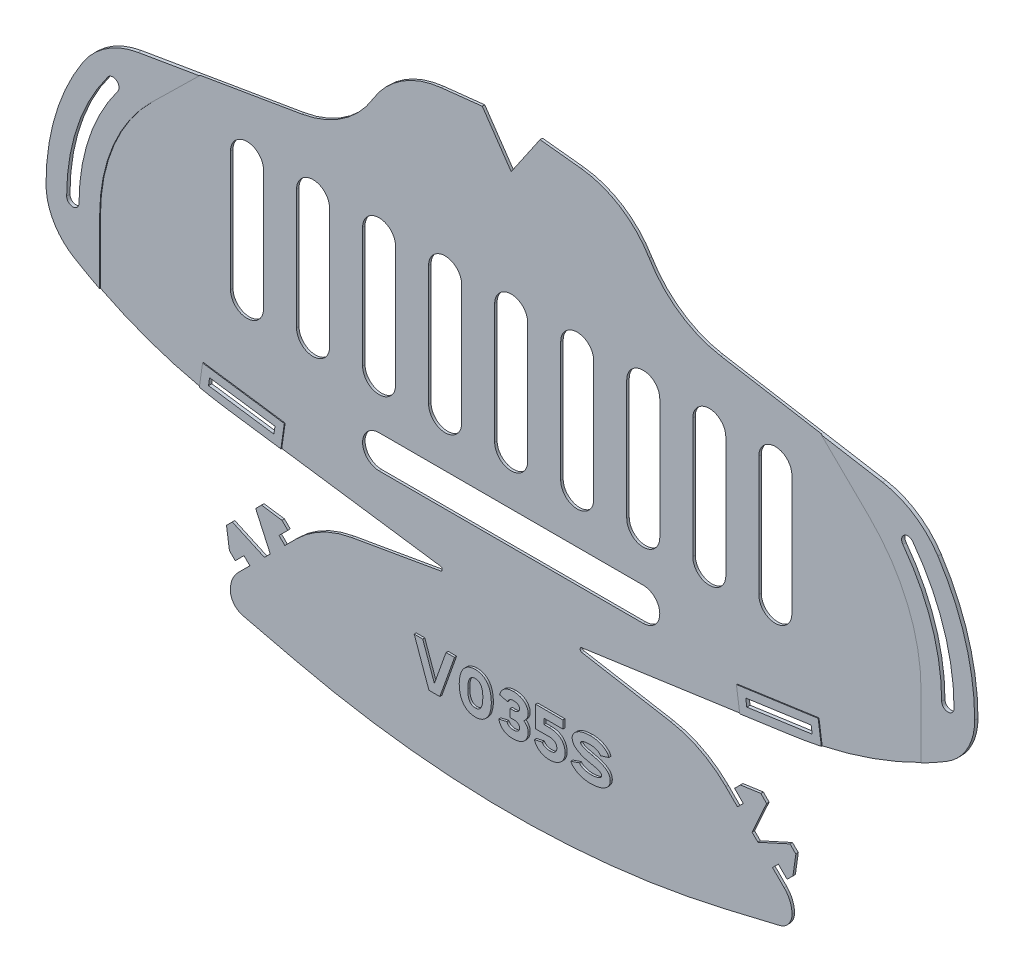
from build123d import *

# Parameters (mm, degrees)
MAIN_SHAPE_DEPTH                   = 0.6
ELASTIC_ATTACHMENT_POINTS_DEPTH    = 184.525502315
REINFORCED_ATTACHMENT_POINTS_DEPTH = 0.2
TAB_SLITS_DEPTH                    = 184.525502315
REINFORCED_TAB_SLITS_DEPTH         = 0.2
TAB_FLEX_RELIEF_DEPTH              = 184.525502315
TAB_FLEX_RELIEF_DEPTH_BACK         = 184.525502315
BREATHING_SLITS_DEPTH              = 184.525502315
VERSION_NUMBER_DEPTH               = 0.5
FILLET1_R                          = 0.5


with BuildPart() as part:
    # Sketch1 → Main Shape (new body)
    with BuildSketch(Plane.XY):
        with BuildLine():
            Line((0, -10.235233266), (-7, 0))
            Line((-7, 0), (-16.941855461, -1.076805455))
            ThreePointArc((-16.941855461, -1.076805455), (-26.448172688, -4.42923559), (-33.461443341, -11.669600897))
            ThreePointArc((-33.461443341, -11.669600897), (-40.804108255, -19.481824954), (-50.74391922, -23.5))
            Line((-50.74391922, -23.5), (-90.180351554, -30.190874742))
            ThreePointArc((-90.180351554, -30.190874742), (-97.811505455, -33.190405434), (-103.597722286, -39))
            ThreePointArc((-103.597722286, -39), (-110.227482046, -53.35351039), (-112.5, -69))
            ThreePointArc((-112.5, -69), (-110.685143325, -75.893640703), (-105.711102551, -81))
            ThreePointArc((-105.711102551, -81), (-87.655491519, -89.524485559), (-68.266232563, -94.291935705))
            Line((-68.266232563, -94.291935705), (-14, -102))
            Line((-14, -102), (-38.626554922, -106.304973016))
            ThreePointArc((-38.626554922, -106.304973016), (-45.849449199, -108.748014338), (-52, -113.254607005))
            Line((-52, -113.254607005), (-54.828307349, -116.0831539))
            Line((-54.828307349, -116.0831539), (-56.242580797, -114.669000226))
            Line((-56.242580797, -114.669000226), (-54.121350285, -112.547590054))
            Line((-54.121350285, -112.547590054), (-55.535623732, -111.13343638))
            Line((-55.535623732, -111.13343638), (-60.48540114, -110.426539202))
            Line((-60.48540114, -110.426539202), (-68.970323187, -118.912179887))
            Line((-68.970323187, -118.912179887), (-68.263006804, -123.861897408))
            Line((-68.263006804, -123.861897408), (-66.848733357, -125.276051082))
            Line((-66.848733357, -125.276051082), (-64.727502845, -123.154640911))
            Line((-64.727502845, -123.154640911), (-63.313229397, -124.568794586))
            Line((-63.313229397, -124.568794586), (-66.141536747, -127.397341481))
            ThreePointArc((-66.141536747, -127.397341481), (-67.550417669, -129.506025763), (-68.045148042, -131.993340924))
            ThreePointArc((-68.045148042, -131.993340924), (-67.183295285, -134.473669911), (-64.9691321, -135.885159709))
            Line((-64.9691321, -135.885159709), (-52.436095294, -138.860716087))
            ThreePointArc((-52.436095294, -138.860716087), (-26.397134772, -143.459954927), (0, -145))
            ThreePointArc((0, -145), (26.397134772, -143.459954927), (52.436095294, -138.860716087))
            Line((52.436095294, -138.860716087), (64.9691321, -135.885159709))
            ThreePointArc((64.9691321, -135.885159709), (67.183295285, -134.473669911), (68.045148042, -131.993340924))
            ThreePointArc((68.045148042, -131.993340924), (67.550417669, -129.506025763), (66.141536747, -127.397341481))
            Line((66.141536747, -127.397341481), (63.313229397, -124.568794586))
            Line((63.313229397, -124.568794586), (64.727502845, -123.154640911))
            Line((64.727502845, -123.154640911), (66.848733357, -125.276051082))
            Line((66.848733357, -125.276051082), (68.263006804, -123.861897408))
            Line((68.263006804, -123.861897408), (68.970323187, -118.912179887))
            Line((68.970323187, -118.912179887), (60.48540114, -110.426539202))
            Line((60.48540114, -110.426539202), (55.535623732, -111.13343638))
            Line((55.535623732, -111.13343638), (54.121350285, -112.547590054))
            Line((54.121350285, -112.547590054), (56.242580797, -114.669000226))
            Line((56.242580797, -114.669000226), (54.828307349, -116.0831539))
            Line((54.828307349, -116.0831539), (52, -113.254607005))
            ThreePointArc((52, -113.254607005), (45.849449199, -108.748014338), (38.626554922, -106.304973016))
            Line((38.626554922, -106.304973016), (14, -102))
            Line((14, -102), (68.266232563, -94.291935705))
            ThreePointArc((68.266232563, -94.291935705), (87.655491519, -89.524485559), (105.711102551, -81))
            ThreePointArc((105.711102551, -81), (110.685143325, -75.893640703), (112.5, -69))
            ThreePointArc((112.5, -69), (110.227482046, -53.35351039), (103.597722286, -39))
            ThreePointArc((103.597722286, -39), (97.811505455, -33.190405434), (90.180351554, -30.190874742))
            Line((90.180351554, -30.190874742), (50.74391922, -23.5))
            ThreePointArc((50.74391922, -23.5), (40.804108255, -19.481824954), (33.461443341, -11.669600897))
            ThreePointArc((33.461443341, -11.669600897), (26.448172688, -4.42923559), (16.941855461, -1.076805455))
            Line((16.941855461, -1.076805455), (7, 0))
            Line((7, 0), (0, -10.235233266))
        make_face()
    extrude(amount=MAIN_SHAPE_DEPTH)

    # Sketch2 → Elastic Attachment Points (cut, through all)
    with BuildSketch(Plane.XY.offset(0.6)):
        with BuildLine():
            ThreePointArc((-97.5, -39), (-104.934164903, -53.188611699), (-107.5, -69))
            ThreePointArc((-107.5, -69), (-106, -70.5), (-104.5, -69))
            ThreePointArc((-104.5, -69), (-102.088115008, -54.137294997), (-95.1, -40.8))
            ThreePointArc((-95.1, -40.8), (-95.4, -38.7), (-97.5, -39))
        make_face()
        with BuildLine():
            ThreePointArc((97.5, -39), (104.934164903, -53.188611699), (107.5, -69))
            ThreePointArc((107.5, -69), (106, -70.5), (104.5, -69))
            ThreePointArc((104.5, -69), (102.088115008, -54.137294997), (95.1, -40.8))
            ThreePointArc((95.1, -40.8), (95.4, -38.7), (97.5, -39))
        make_face()
    extrude(amount=-ELASTIC_ATTACHMENT_POINTS_DEPTH, mode=Mode.SUBTRACT)

    # Sketch7 → Reinforced Attachment Points (add)
    # profile 1 of 2: a face of its own
    with BuildSketch(Plane.XY.offset(0.6)):
        with BuildLine():
            Line((-99.5, -69), (-99.5, -84.438405623))
            ThreePointArc((-99.5, -84.438405623), (-102.636073846, -82.774338486), (-105.711102551, -81))
            ThreePointArc((-105.711102551, -81), (-110.685143325, -75.893640703), (-112.5, -69))
            ThreePointArc((-112.5, -69), (-110.227482046, -53.35351039), (-103.597722286, -39))
            ThreePointArc((-103.597722286, -39), (-97.811505455, -33.190405434), (-90.180351554, -30.190874742))
            Line((-90.180351554, -30.190874742), (-75.331937335, -27.671659038))
            Line((-75.331937335, -27.671659038), (-86.893876913, -39))
            ThreePointArc((-86.893876913, -39), (-96.22042633, -52.729517991), (-99.5, -69))
        make_face()
        with BuildLine():
            ThreePointArc((-107.5, -69), (-106, -70.5), (-104.5, -69))
            ThreePointArc((-104.5, -69), (-102.088115008, -54.137294997), (-95.1, -40.8))
            ThreePointArc((-95.1, -40.8), (-95.4, -38.7), (-97.5, -39))
            ThreePointArc((-97.5, -39), (-104.934164903, -53.188611699), (-107.5, -69))
        make_face(mode=Mode.SUBTRACT)
    # profile 2 of 2: a face of its own
    with BuildSketch(Plane.XY.offset(0.6)):
        with BuildLine():
            Line((75.331937335, -27.671659038), (90.180351554, -30.190874742))
            ThreePointArc((90.180351554, -30.190874742), (97.811505455, -33.190405434), (103.597722286, -39))
            ThreePointArc((103.597722286, -39), (110.227482046, -53.35351039), (112.5, -69))
            ThreePointArc((112.5, -69), (110.685143325, -75.893640703), (105.711102551, -81))
            ThreePointArc((105.711102551, -81), (102.636073846, -82.774338486), (99.5, -84.438405623))
            Line((99.5, -84.438405623), (99.5, -69))
            ThreePointArc((99.5, -69), (96.22042633, -52.729517991), (86.893876913, -39))
            Line((86.893876913, -39), (75.331937335, -27.671659038))
        make_face()
        with BuildLine():
            ThreePointArc((104.5, -69), (106, -70.5), (107.5, -69))
            ThreePointArc((107.5, -69), (104.934164903, -53.188611699), (97.5, -39))
            ThreePointArc((97.5, -39), (95.4, -38.7), (95.1, -40.8))
            ThreePointArc((95.1, -40.8), (102.088115008, -54.137294997), (104.5, -69))
        make_face(mode=Mode.SUBTRACT)
    extrude(amount=REINFORCED_ATTACHMENT_POINTS_DEPTH)

    # Sketch6 → Tab Slits (cut, through all)
    with BuildSketch(Plane.XY.offset(0.6)):
        Polygon((-73.122472744, -91.582072346), (-57.281477317, -93.832153206), (-57.02834322, -92.050041221), (-72.869338647, -89.79996036), align=None)
        Polygon((73.122472744, -91.582072346), (72.869338647, -89.79996036), (57.02834322, -92.050041221), (57.281477317, -93.832153206), align=None)
    extrude(amount=-TAB_SLITS_DEPTH, mode=Mode.SUBTRACT)

    # Sketch9 → Reinforced Tab Slits (add)
    # profile 1 of 2: a face of its own
    with BuildSketch(Plane.XY.offset(0.6)):
        with BuildLine():
            Line((-55.582612996, -96.093537742), (-54.766958684, -90.3511769))
            Line((-54.766958684, -90.3511769), (-74.568202968, -87.538575825))
            Line((-74.568202968, -87.538575825), (-75.347469499, -93.024759795))
            ThreePointArc((-75.347469499, -93.024759795), (-71.81824936, -93.72204393), (-68.266232563, -94.291935705))
            Line((-68.266232563, -94.291935705), (-55.582612996, -96.093537742))
        make_face()
        Polygon((-57.281477317, -93.832153206), (-57.02834322, -92.050041221), (-72.869338647, -89.79996036), (-73.122472744, -91.582072346), align=None, mode=Mode.SUBTRACT)
    # profile 2 of 2: a face of its own
    with BuildSketch(Plane.XY.offset(0.6)):
        with BuildLine():
            Line((68.266232563, -94.291935705), (55.582612996, -96.093537742))
            Line((55.582612996, -96.093537742), (54.766958684, -90.3511769))
            Line((54.766958684, -90.3511769), (74.568202968, -87.538575825))
            Line((74.568202968, -87.538575825), (75.347469499, -93.024759795))
            ThreePointArc((75.347469499, -93.024759795), (71.81824936, -93.72204393), (68.266232563, -94.291935705))
        make_face()
        Polygon((57.02834322, -92.050041221), (72.869338647, -89.79996036), (73.122472744, -91.582072346), (57.281477317, -93.832153206), align=None, mode=Mode.SUBTRACT)
    extrude(amount=REINFORCED_TAB_SLITS_DEPTH)

    # Sketch11 → Tab Flex Relief (cut, two sides: drawn at the far end of the back side and taken through both)
    with BuildSketch(Plane.XY.offset(0.6).offset(-TAB_FLEX_RELIEF_DEPTH_BACK)):
        Polygon((-67.556169513, -117.49790644), (-59.777845211, -121.033110967), (-58.363691536, -119.618837519), (-61.899554814, -111.840812649), align=None)
        Polygon((61.899554814, -111.840812649), (67.556169513, -117.49790644), (59.777845211, -121.033110967), (58.363691536, -119.618837519), align=None)
    extrude(amount=TAB_FLEX_RELIEF_DEPTH + TAB_FLEX_RELIEF_DEPTH_BACK, mode=Mode.SUBTRACT)

    # Sketch3 → Breathing Slits (cut, through all)
    with BuildSketch(Plane.XY.offset(0.6)):
        with BuildLine():
            Line((4, -39.9), (4, -69))
            ThreePointArc((4, -69), (0, -73), (-4, -69))
            Line((-4, -69), (-4, -39.9))
            ThreePointArc((-4, -39.9), (0, -35.9), (4, -39.9))
        make_face()
        with BuildLine():
            Line((-12, -39.9), (-12, -69))
            ThreePointArc((-12, -69), (-16, -73), (-20, -69))
            Line((-20, -69), (-20, -39.9))
            ThreePointArc((-20, -39.9), (-16, -35.9), (-12, -39.9))
        make_face()
        with BuildLine():
            Line((-28, -39.9), (-28, -69))
            ThreePointArc((-28, -69), (-32, -73), (-36, -69))
            Line((-36, -69), (-36, -39.9))
            ThreePointArc((-36, -39.9), (-32, -35.9), (-28, -39.9))
        make_face()
        with BuildLine():
            Line((-32, -81), (32, -81))
            ThreePointArc((32, -81), (36, -85), (32, -89))
            Line((32, -89), (-32, -89))
            ThreePointArc((-32, -89), (-36, -85), (-32, -81))
        make_face()
        with BuildLine():
            Line((-44, -39.9), (-44, -69))
            ThreePointArc((-44, -69), (-48, -73), (-52, -69))
            Line((-52, -69), (-52, -39.9))
            ThreePointArc((-52, -39.9), (-48, -35.9), (-44, -39.9))
        make_face()
        with BuildLine():
            Line((-60, -39.9), (-60, -69))
            ThreePointArc((-60, -69), (-64, -73), (-68, -69))
            Line((-68, -69), (-68, -39.9))
            ThreePointArc((-68, -39.9), (-64, -35.9), (-60, -39.9))
        make_face()
        with BuildLine():
            Line((12, -39.9), (12, -69))
            ThreePointArc((12, -69), (16, -73), (20, -69))
            Line((20, -69), (20, -39.9))
            ThreePointArc((20, -39.9), (16, -35.9), (12, -39.9))
        make_face()
        with BuildLine():
            Line((28, -39.9), (28, -69))
            ThreePointArc((28, -69), (32, -73), (36, -69))
            Line((36, -69), (36, -39.9))
            ThreePointArc((36, -39.9), (32, -35.9), (28, -39.9))
        make_face()
        with BuildLine():
            Line((44, -39.9), (44, -69))
            ThreePointArc((44, -69), (48, -73), (52, -69))
            Line((52, -69), (52, -39.9))
            ThreePointArc((52, -39.9), (48, -35.9), (44, -39.9))
        make_face()
        with BuildLine():
            Line((60, -39.9), (60, -69))
            ThreePointArc((60, -69), (64, -73), (68, -69))
            Line((68, -69), (68, -39.9))
            ThreePointArc((68, -39.9), (64, -35.9), (60, -39.9))
        make_face()
    extrude(amount=-BREATHING_SLITS_DEPTH, mode=Mode.SUBTRACT)

    # Sketch8 → Version Number (add)
    # profile 1 of 5: a face of its own
    with BuildSketch(Plane.XY.offset(0.6)):
        Polygon((-19.423503187, -128.5), (-16.788582552, -128.5), (-13.21715398, -118.5), (-15.280646044, -118.5), (-18.106042869, -126.420634921), (-20.931439695, -118.5), (-22.994931758, -118.5), align=None)
    # profile 2 of 5: a face of its own
    with BuildSketch(Plane.XY.offset(0.6)):
        with BuildLine():
            add(Edge.make_bspline(
                [(-8.194979301, -118.5), (-8.339345265, -118.505695671), (-8.622100412, -118.51685121), (-9.035235414, -118.5745591), (-9.423078117, -118.680335178), (-9.790279692, -118.819656178), (-10.132555264, -119.003303471), (-10.456348439, -119.221085059), (-10.749359054, -119.487440084), (-11.024814107, -119.785519386), (-11.270677287, -120.12453761), (-11.484112997, -120.500892889), (-11.666075773, -120.912503383), (-11.814996937, -121.360169436), (-11.930545985, -121.844506854), (-12.018299924, -122.364485904), (-12.069854364, -122.921030718), (-12.080511094, -123.303893775), (-12.085989675, -123.500722112)],
                knots=[0, 0, 0, 0, 0.970159994, 1.900155169, 2.79438565, 3.665191596, 4.532301255, 5.397946305, 6.279238358, 7.185391655, 8.120220805, 9.085107467, 10.08639026, 11.138349125, 12.249459105, 13.427760297, 14.677622047, 16, 16, 16, 16], degree=3))
            add(Edge.make_bspline(
                [(-12.085989675, -123.500722112), (-12.080566284, -123.69832053), (-12.070057658, -124.081196856), (-12.018090588, -124.637697099), (-11.930644698, -125.156966907), (-11.814534842, -125.641884177), (-11.666592179, -126.090648826), (-11.484045554, -126.502814664), (-11.270735249, -126.879260377), (-11.024654069, -127.218032326), (-10.750262332, -127.51659595), (-10.454794786, -127.779877259), (-10.133443543, -128.000979952), (-9.790086238, -128.183632701), (-9.423533184, -128.324409639), (-9.034580104, -128.425104033), (-8.622801784, -128.488808035), (-8.34002041, -128.496221224), (-8.195876335, -128.5)],
                knots=[0, 0, 0, 0, 1.327400251, 2.57203543, 3.750234214, 4.861247624, 5.917991082, 6.919186852, 7.883989653, 8.818737555, 9.724812096, 10.602616666, 11.47109776, 12.338132057, 13.208862319, 14.101698703, 15.032365954, 16, 16, 16, 16], degree=3))
            add(Edge.make_bspline(
                [(-8.195876335, -128.5), (-8.051736666, -128.496210687), (-7.768963937, -128.488776824), (-7.357123523, -128.425221319), (-6.967701192, -128.323813307), (-6.600339713, -128.184839888), (-6.257950234, -128.000200623), (-5.936903828, -127.779984633), (-5.641505159, -127.516566079), (-5.367095359, -127.218040576), (-5.121014732, -126.879258594), (-4.90772199, -126.502813072), (-4.725100113, -126.090657611), (-4.577462376, -125.641847927), (-4.460149525, -125.157235462), (-4.377707379, -124.637275213), (-4.320051154, -124.081441513), (-4.312140786, -123.698369528), (-4.308059402, -123.500722112)],
                knots=[0, 0, 0, 0, 0.96765053, 1.898333634, 2.791185227, 3.666728435, 4.529238626, 5.397734515, 6.275554038, 7.181644014, 8.116407839, 9.081227075, 10.082439899, 11.139201358, 12.250233695, 13.427610983, 14.672766316, 16, 16, 16, 16], degree=3))
            add(Edge.make_bspline(
                [(-4.308059402, -123.500722112), (-4.312200232, -123.303845261), (-4.320256936, -122.920787111), (-4.377500915, -122.364907693), (-4.460249109, -121.844238468), (-4.576998745, -121.360205444), (-4.72561671, -120.912494629), (-4.907654528, -120.500894477), (-5.121072705, -120.124539393), (-5.366935299, -119.785511139), (-5.642408536, -119.487469991), (-5.935349744, -119.220977415), (-6.258834607, -119.004075275), (-6.600146255, -118.818455332), (-6.968156818, -118.680915067), (-7.356473451, -118.574534625), (-7.769322528, -118.516562336), (-8.051807359, -118.506550382), (-8.195876335, -118.501444225)],
                knots=[0, 0, 0, 0, 1.322391154, 2.572941942, 3.750582404, 4.861863084, 5.913983562, 6.915420183, 7.880455081, 8.815427849, 9.721720359, 10.603147806, 11.468925845, 12.331628829, 13.207367743, 14.101735605, 15.031873656, 16, 16, 16, 16], degree=3))
            Line((-8.195876335, -118.501444225), (-8.194979301, -118.5))
        make_face()
        with BuildLine():
            add(Edge.make_bspline(
                [(-8.194979301, -126.579365079), (-8.264298849, -126.580142247), (-8.400309175, -126.581667111), (-8.597762411, -126.549518886), (-8.784213506, -126.50001124), (-8.958390802, -126.424863461), (-9.122186162, -126.32888552), (-9.272801706, -126.207295998), (-9.411160729, -126.063513987), (-9.538475787, -125.896932623), (-9.652347089, -125.703005633), (-9.750878078, -125.478827118), (-9.831615493, -125.222713054), (-9.900792251, -124.937433189), (-9.952043616, -124.621763618), (-9.990547181, -124.276117752), (-10.016413845, -123.899148475), (-10.01977312, -123.63702081), (-10.021519845, -123.500722112)],
                knots=[0, 0, 0, 0, 0.820209436, 1.609314487, 2.362064528, 3.101854642, 3.850272983, 4.605479342, 5.3882482, 6.210255141, 7.084711649, 8.047345167, 9.106040688, 10.263495908, 11.523832392, 12.893430008, 14.384674726, 16, 16, 16, 16], degree=3))
            add(Edge.make_bspline(
                [(-10.021519845, -123.500722112), (-10.019766233, -123.364424703), (-10.016393714, -123.102299516), (-9.99061807, -122.725313211), (-9.951725095, -122.378974061), (-9.901428811, -122.063111109), (-9.831211388, -121.778059679), (-9.750908357, -121.522619394), (-9.652378197, -121.298401339), (-9.538343537, -121.104640769), (-9.411953233, -120.937923887), (-9.271990747, -120.796456824), (-9.122269996, -120.674830172), (-8.958430111, -120.578630118), (-8.783784091, -120.50465551), (-8.598416544, -120.450210023), (-8.400272836, -120.423926373), (-8.264829563, -120.422146526), (-8.195876335, -120.421240419)],
                knots=[0, 0, 0, 0, 1.616177311, 3.108208617, 4.478528655, 5.748482895, 6.897727805, 7.956981757, 8.920123036, 9.795040793, 10.617481319, 11.394165711, 12.149770419, 12.898583529, 13.63876386, 14.394368568, 15.182584207, 16, 16, 16, 16], degree=3))
            add(Edge.make_bspline(
                [(-8.195876335, -120.421240419), (-8.1269247, -120.422149219), (-7.991484555, -120.423934355), (-7.793318335, -120.450179948), (-7.608031747, -120.504762296), (-7.4336984, -120.577982734), (-7.271473065, -120.675595023), (-7.122003307, -120.796360516), (-6.982103061, -120.937948802), (-6.855738749, -121.104645093), (-6.741514011, -121.298351736), (-6.643728731, -121.523063414), (-6.559768872, -121.777554553), (-6.490579773, -122.063195246), (-6.439950095, -122.378948588), (-6.40115798, -122.725320897), (-6.375352316, -123.102297333), (-6.371984165, -123.364423957), (-6.370232825, -123.500722112)],
                knots=[0, 0, 0, 0, 0.817669415, 1.606129616, 2.361968767, 3.102378757, 3.843623451, 4.599462602, 5.376387978, 6.199083685, 7.074272906, 8.037713021, 9.100132017, 10.249733507, 11.520081779, 12.89082699, 14.383321233, 16, 16, 16, 16], degree=3))
            add(Edge.make_bspline(
                [(-6.370232825, -123.500722112), (-6.371977279, -123.637021556), (-6.375332187, -123.899150658), (-6.401228862, -124.276110066), (-6.439631812, -124.621789015), (-6.491215031, -124.937349474), (-6.559356896, -125.223220708), (-6.643758409, -125.478383327), (-6.741545264, -125.703055181), (-6.855606442, -125.896928348), (-6.982895585, -126.063488884), (-7.121191675, -126.207393621), (-7.271555765, -126.328120602), (-7.433736992, -126.425517476), (-7.607602242, -126.499891817), (-7.79397158, -126.549600883), (-7.991161208, -126.581404352), (-8.126859744, -126.580608552), (-8.195876335, -126.580203806)],
                knots=[0, 0, 0, 0, 1.616177474, 3.108208932, 4.478529109, 5.739530511, 6.897596372, 7.959685938, 8.922827315, 9.797745161, 10.620185771, 11.403367596, 12.15897238, 12.899987232, 13.640167639, 14.39331481, 15.182836171, 16, 16, 16, 16], degree=3))
            Line((-8.195876335, -126.580203806), (-8.194979301, -126.579365079))
        make_face(mode=Mode.SUBTRACT)
    # profile 3 of 5: a face of its own
    with BuildSketch(Plane.XY.offset(0.6)):
        with BuildLine():
            Line((1.127625506, -124.404761905), (1.222863602, -124.404761905))
            add(Edge.make_bspline(
                [(1.222863602, -124.404761905), (1.323131497, -124.411299477), (1.513766698, -124.423729091), (1.780432995, -124.486416557), (2.013227083, -124.578961335), (2.204914461, -124.709274647), (2.358559762, -124.861365804), (2.472887201, -125.032278467), (2.542548445, -125.222537651), (2.551423882, -125.355662585), (2.555900914, -125.422814713)],
                knots=[0, 0, 0, 0, 1.293250512, 2.458803691, 3.516087315, 4.504014474, 5.424976382, 6.287022232, 7.135923681, 8, 8, 8, 8], degree=3))
            add(Edge.make_bspline(
                [(2.555900914, -125.422814713), (2.552611363, -125.504440638), (2.546250377, -125.662280257), (2.477103006, -125.887718235), (2.358748148, -126.087113891), (2.223832311, -126.23073656), (2.094667656, -126.331172702), (1.97977866, -126.395688771), (1.850927761, -126.450185226), (1.707899755, -126.49595932), (1.551178295, -126.532200484), (1.380219358, -126.560253509), (1.194395636, -126.575366879), (1.06555664, -126.5785552), (0.998937015, -126.580203806)],
                knots=[0, 0, 0, 0, 1.334208421, 2.579951764, 3.816761299, 5.103436918, 5.78324123, 6.491044783, 7.25516555, 8.072210043, 8.94833879, 9.888551629, 10.908219533, 12, 12, 12, 12], degree=3))
            add(Edge.make_bspline(
                [(0.998937015, -126.580203806), (0.924543424, -126.579024673), (0.774058831, -126.576639503), (0.547412285, -126.537785365), (0.319137327, -126.472292557), (0.092039927, -126.384048723), (-0.122116673, -126.26078738), (-0.299439202, -126.088542309), (-0.440608958, -125.87591894), (-0.495178112, -125.712337396), (-0.52358078, -125.62719493)],
                knots=[0, 0, 0, 0, 0.920255672, 1.861508472, 2.836752399, 3.857684402, 4.873720033, 5.872631744, 6.892727297, 8, 8, 8, 8], degree=3))
            Line((-0.52358078, -125.62719493), (-2.507295129, -126.071428571))
            add(Edge.make_bspline(
                [(-2.507295129, -126.071428571), (-2.484459844, -126.160336196), (-2.439503699, -126.335369884), (-2.34649482, -126.586847228), (-2.235057383, -126.824009097), (-2.109901039, -127.050933458), (-1.961749952, -127.26169635), (-1.797581413, -127.459934114), (-1.618349884, -127.647890635), (-1.418017591, -127.819546753), (-1.200570613, -127.976110236), (-0.963424039, -128.112422888), (-0.708858541, -128.230322428), (-0.433321152, -128.322934743), (-0.141203536, -128.399729339), (0.170065033, -128.45295857), (0.498896012, -128.491934936), (0.724777504, -128.497268097), (0.840484937, -128.5)],
                knots=[0, 0, 0, 0, 0.97897001, 1.927311989, 2.855460552, 3.773345826, 4.68872018, 5.599601379, 6.518067916, 7.456260856, 8.41049365, 9.372940738, 10.370680865, 11.39871829, 12.470472684, 13.590411754, 14.765692276, 16, 16, 16, 16], degree=3))
            add(Edge.make_bspline(
                [(0.840484937, -128.5), (0.996754822, -128.494245394), (1.299280873, -128.483104934), (1.737089662, -128.435865678), (2.142738044, -128.358387224), (2.516512836, -128.252017359), (2.861386529, -128.123277608), (3.17237195, -127.961059217), (3.454463385, -127.774497038), (3.702117407, -127.55815064), (3.91651212, -127.319870658), (4.108269694, -127.071551477), (4.266058985, -126.805353082), (4.398589639, -126.527874631), (4.497217263, -126.234513517), (4.568680967, -125.928607165), (4.610353368, -125.607680152), (4.615471001, -125.38925418), (4.618074337, -125.278141077)],
                knots=[0, 0, 0, 0, 1.338573179, 2.591371041, 3.766159492, 4.869841347, 5.915366975, 6.911991706, 7.866279139, 8.804635322, 9.718527085, 10.607232931, 11.486170613, 12.362759498, 13.235296616, 14.130311397, 15.048891017, 16, 16, 16, 16], degree=3))
            add(Edge.make_bspline(
                [(4.618074337, -125.278141077), (4.61272591, -125.181448476), (4.602199151, -124.991138356), (4.546883566, -124.713321084), (4.454523678, -124.451246621), (4.325331939, -124.20784025), (4.174132234, -123.977552327), (3.999000817, -123.764837772), (3.804603771, -123.566155092), (3.660179105, -123.449574998), (3.586987625, -123.39049458)],
                knots=[0, 0, 0, 0, 1.042147361, 2.051151675, 3.039496243, 4.024119517, 5.012016893, 6.002285516, 6.987598979, 8, 8, 8, 8], degree=3))
            add(Edge.make_bspline(
                [(3.586987625, -123.39049458), (3.66016866, -123.325162044), (3.804529417, -123.19628365), (3.998801539, -122.981710509), (4.172972245, -122.755542958), (4.326327997, -122.515248899), (4.453529521, -122.261642739), (4.54635361, -121.993228321), (4.602261874, -121.711764564), (4.612747261, -121.519933272), (4.618074337, -121.42247384)],
                knots=[0, 0, 0, 0, 1.026734164, 2.025389794, 3.025877614, 4.013273499, 5.006315215, 5.989929209, 6.978788314, 8, 8, 8, 8], degree=3))
            add(Edge.make_bspline(
                [(4.618074337, -121.42247384), (4.613992472, -121.322020203), (4.605973493, -121.124675201), (4.559030795, -120.835115028), (4.483852781, -120.558271626), (4.376410723, -120.294880847), (4.242995128, -120.042407113), (4.078183213, -119.803370965), (3.887154035, -119.574583887), (3.666323177, -119.361344215), (3.419624019, -119.166999953), (3.147815802, -118.995833154), (2.853277113, -118.84746887), (2.53250106, -118.730513446), (2.190585443, -118.632405283), (1.824705607, -118.562780212), (1.435630452, -118.515976725), (1.16824236, -118.506371293), (1.031086712, -118.501444225)],
                knots=[0, 0, 0, 0, 0.933249724, 1.833404674, 2.71837752, 3.592513965, 4.4704886, 5.365912677, 6.284554944, 7.234984132, 8.212272519, 9.196674926, 10.214289296, 11.269589965, 12.363543901, 13.515449053, 14.72555956, 16, 16, 16, 16], degree=3))
            add(Edge.make_bspline(
                [(1.031086712, -118.501444225), (0.917694359, -118.504384419), (0.6965136, -118.510119502), (0.373729331, -118.546209564), (0.067900026, -118.597359567), (-0.2209187, -118.671164203), (-0.491962257, -118.76520159), (-0.74568434, -118.877770477), (-0.982213874, -119.009217236), (-1.199817144, -119.161041577), (-1.40007772, -119.328960798), (-1.581474708, -119.510905494), (-1.746221701, -119.704452098), (-1.890755877, -119.91288512), (-2.020385352, -120.132286581), (-2.126920381, -120.36651166), (-2.22183934, -120.610059019), (-2.265243558, -120.780460499), (-2.287221303, -120.866743363)],
                knots=[0, 0, 0, 0, 1.229240767, 2.397731417, 3.51786287, 4.588673614, 5.625367482, 6.624717489, 7.594406979, 8.554388623, 9.496885304, 10.424058211, 11.336820069, 12.248524965, 13.170856983, 14.095351914, 15.035580601, 16, 16, 16, 16], degree=3))
            Line((-2.287221303, -120.866743363), (-0.380311002, -121.373015873))
            add(Edge.make_bspline(
                [(-0.380311002, -121.373015873), (-0.369013351, -121.326631527), (-0.344497176, -121.22597637), (-0.253996048, -121.081457089), (-0.132147374, -120.927147787), (0.029065401, -120.771324055), (0.226443174, -120.625559671), (0.464533152, -120.514206488), (0.737617538, -120.446844288), (0.930446976, -120.430020784), (1.031086712, -120.421240419)],
                knots=[0, 0, 0, 0, 0.626586808, 1.359708585, 2.222843852, 3.223153095, 4.308434095, 5.447412619, 6.667777482, 8, 8, 8, 8], degree=3))
            add(Edge.make_bspline(
                [(1.031086712, -120.421240419), (1.103119698, -120.423218633), (1.241355187, -120.42701494), (1.438758508, -120.449676308), (1.619050136, -120.474391788), (1.780099542, -120.515621967), (1.925714549, -120.558109891), (2.050323735, -120.618078056), (2.16108507, -120.680273756), (2.275988758, -120.780934624), (2.390316748, -120.912654377), (2.493310701, -121.077310889), (2.553307716, -121.24921056), (2.555046784, -121.365405566), (2.555900914, -121.42247384)],
                knots=[0, 0, 0, 0, 1.26888152, 2.435057415, 3.499383416, 4.470882074, 5.362320585, 6.164854387, 6.902680001, 7.591682225, 8.843898063, 9.963361673, 10.999720905, 12, 12, 12, 12], degree=3))
            add(Edge.make_bspline(
                [(2.555900914, -121.42247384), (2.55083016, -121.49199044), (2.540751961, -121.630155711), (2.465473149, -121.827940252), (2.343947836, -122.008163808), (2.180621089, -122.171288708), (1.973285181, -122.307565764), (1.725748205, -122.408872593), (1.438867872, -122.47003825), (1.235013028, -122.480300003), (1.127535803, -122.485710249)],
                knots=[0, 0, 0, 0, 0.842573162, 1.674626639, 2.532888499, 3.465967991, 4.458251597, 5.524776888, 6.695002246, 8, 8, 8, 8], degree=3))
            Line((1.127535803, -122.485710249), (0.270482649, -122.484126984))
            Line((0.270482649, -122.484126984), (0.270482649, -124.404761905))
            Line((0.270482649, -124.404761905), (1.127625506, -124.404761905))
        make_face()
    # profile 4 of 5: a face of its own
    with BuildSketch(Plane.XY.offset(0.6)):
        with BuildLine():
            Line((9.775337845, -121.753968254), (8.48962356, -121.753968254))
            Line((8.48962356, -121.753968254), (8.48962356, -120.420634921))
            Line((8.48962356, -120.420634921), (13.029306099, -120.420634921))
            Line((13.029306099, -120.420634921), (13.029306099, -118.5))
            Line((13.029306099, -118.5), (6.426131496, -118.5))
            Line((6.426131496, -118.5), (6.426131496, -123.674603175))
            Line((6.426131496, -123.674603175), (9.695972766, -123.674603175))
            add(Edge.make_bspline(
                [(9.695972766, -123.674603175), (9.770062115, -123.675602086), (9.91401415, -123.677542922), (10.123460776, -123.692704514), (10.318978823, -123.723042675), (10.500502342, -123.763288516), (10.667602661, -123.817251662), (10.822190602, -123.879484934), (10.959808977, -123.959553064), (11.087188918, -124.046197885), (11.196072308, -124.149968295), (11.292215354, -124.26484275), (11.375238951, -124.390602025), (11.4416013, -124.530129867), (11.494589218, -124.680251755), (11.533495625, -124.842608973), (11.558840613, -125.017132432), (11.564231712, -125.137973815), (11.567001709, -125.200063241)],
                knots=[0, 0, 0, 0, 1.291340122, 2.50901164, 3.656233385, 4.737231688, 5.745647761, 6.71445312, 7.634539433, 8.515488686, 9.393300537, 10.245701923, 11.122702301, 12.011797026, 12.93168986, 13.892747604, 14.917274139, 16, 16, 16, 16], degree=3))
            add(Edge.make_bspline(
                [(11.567001709, -125.200063241), (11.562789358, -125.300114528), (11.554705086, -125.492131264), (11.474439507, -125.765733398), (11.335298012, -126.004538024), (11.176687621, -126.17434082), (11.024931446, -126.290319351), (10.893200701, -126.365431401), (10.747765282, -126.430026061), (10.58741892, -126.482096845), (10.41362545, -126.52675039), (10.223448808, -126.55439299), (10.019749234, -126.576932347), (9.878449386, -126.5790915), (9.805657593, -126.580203806)],
                knots=[0, 0, 0, 0, 1.417186054, 2.719839454, 3.999831516, 5.306419273, 5.988605249, 6.704054952, 7.452945314, 8.243009127, 9.093975494, 9.995834141, 10.967537284, 12, 12, 12, 12], degree=3))
            add(Edge.make_bspline(
                [(9.805657593, -126.580203806), (9.696749565, -126.574841975), (9.486085258, -126.564470411), (9.181135042, -126.511605126), (8.899262033, -126.424404763), (8.645004793, -126.306180725), (8.423919399, -126.167710506), (8.252075586, -126.007163051), (8.120428121, -125.83604344), (8.079975047, -125.706158133), (8.060388326, -125.643269778)],
                knots=[0, 0, 0, 0, 1.239808568, 2.398201666, 3.511107812, 4.586578273, 5.581900341, 6.46310827, 7.255862013, 8, 8, 8, 8], degree=3))
            Line((8.060388326, -125.643269778), (6.14041721, -126.071428571))
            add(Edge.make_bspline(
                [(6.14041721, -126.071428571), (6.16448707, -126.160548359), (6.212117555, -126.336902466), (6.318191702, -126.587616399), (6.442750727, -126.825640703), (6.587255205, -127.052018478), (6.7560353, -127.263372267), (6.945869768, -127.462365132), (7.157354926, -127.648069148), (7.389363249, -127.81997371), (7.638533945, -127.975914274), (7.904782129, -128.111508549), (8.184281354, -128.229596507), (8.480842823, -128.322648571), (8.790541253, -128.399168227), (9.116165995, -128.452814481), (9.455690826, -128.491742739), (9.687661005, -128.49721594), (9.805657593, -128.5)],
                knots=[0, 0, 0, 0, 0.933358014, 1.846969395, 2.747978179, 3.65058438, 4.560476191, 5.481090533, 6.430749403, 7.405393302, 8.400725728, 9.402100456, 10.426556211, 11.46786461, 12.544569044, 13.652675183, 14.805983081, 16, 16, 16, 16], degree=3))
            add(Edge.make_bspline(
                [(9.805657593, -128.5), (9.942863956, -128.495504774), (10.211298897, -128.486710171), (10.602388899, -128.433418982), (10.974273526, -128.360336182), (11.323807622, -128.252803179), (11.655101454, -128.123435212), (11.962945262, -127.960769192), (12.253038848, -127.774871052), (12.51830574, -127.558743904), (12.757671024, -127.321416343), (12.970278951, -127.067668109), (13.14554311, -126.794179288), (13.298778198, -126.509027952), (13.411884226, -126.203081966), (13.497493192, -125.88344012), (13.551130261, -125.5470022), (13.561748041, -125.31737072), (13.567172145, -125.200063241)],
                knots=[0, 0, 0, 0, 1.17826532, 2.30519616, 3.385644728, 4.42967802, 5.441717964, 6.435616201, 7.414838536, 8.396397341, 9.367976222, 10.306520034, 11.232826888, 12.153236024, 13.081197769, 14.026829533, 14.992003824, 16, 16, 16, 16], degree=3))
            add(Edge.make_bspline(
                [(13.567172145, -125.200063241), (13.563031301, -125.073635127), (13.554923199, -124.826078875), (13.509400062, -124.463686468), (13.431321346, -124.120728156), (13.323339044, -123.797399283), (13.184982817, -123.493469509), (13.014000565, -123.211065096), (12.81498814, -122.946164208), (12.585608818, -122.703396477), (12.327315567, -122.484022512), (12.0414827, -122.292954639), (11.728380488, -122.131495081), (11.388879886, -121.998507068), (11.023034048, -121.892820854), (10.63009766, -121.818407366), (10.211011652, -121.769392953), (9.922149119, -121.760188975), (9.773507896, -121.755452845)],
                knots=[0, 0, 0, 0, 1.047845617, 2.051764646, 3.021184748, 3.957929711, 4.871890627, 5.782411277, 6.68821354, 7.612570783, 8.544147221, 9.490634628, 10.455228194, 11.457623096, 12.507540162, 13.606000757, 14.768109627, 16, 16, 16, 16], degree=3))
            Line((9.773507896, -121.755452845), (9.775337845, -121.753968254))
        make_face()
    # profile 5 of 5: a face of its own
    with BuildSketch(Plane.XY.offset(0.6)):
        with BuildLine():
            add(Edge.make_bspline(
                [(24.502415264, -125.531746032), (24.499528312, -125.436285182), (24.493842146, -125.248264664), (24.443910238, -124.971573191), (24.361673237, -124.706487636), (24.243289395, -124.453940642), (24.088921837, -124.214454259), (23.900036554, -123.987830994), (23.677054966, -123.772935761), (23.420124212, -123.570035613), (23.125292151, -123.378876225), (22.79198702, -123.197945262), (22.417697257, -123.029686218), (22.006911266, -122.866007919), (21.555896576, -122.715136729), (21.064738137, -122.576683253), (20.535410869, -122.442048846), (20.166623289, -122.366313826), (19.976443888, -122.327258171)],
                knots=[0, 0, 0, 0, 0.761030942, 1.498933149, 2.234785869, 2.969649761, 3.716667643, 4.501656281, 5.31785169, 6.182843945, 7.109303426, 8.117634967, 9.205209993, 10.38112034, 11.64403038, 12.997003453, 14.451390136, 16, 16, 16, 16], degree=3))
            add(Edge.make_bspline(
                [(19.976443888, -122.327258171), (19.870699477, -122.30555769), (19.664907938, -122.263325903), (19.367445595, -122.193679101), (19.089649929, -122.126464334), (18.833763616, -122.053760118), (18.596592199, -121.983655528), (18.379988763, -121.910448671), (18.183369844, -121.837446954), (18.007852882, -121.761475107), (17.852396032, -121.683760331), (17.715519645, -121.606491372), (17.600430495, -121.52614758), (17.504607673, -121.445158589), (17.427588346, -121.363937692), (17.373530085, -121.278672354), (17.335986204, -121.192692147), (17.329549128, -121.132708689), (17.326390291, -121.103273277)],
                knots=[0, 0, 0, 0, 1.70301331, 3.314271901, 4.819820312, 6.211652842, 7.510691048, 8.721335644, 9.818207508, 10.818842107, 11.737003788, 12.55938616, 13.296472535, 13.947505605, 14.537298364, 15.05322349, 15.535392622, 16, 16, 16, 16], degree=3))
            add(Edge.make_bspline(
                [(17.326390291, -121.103273277), (17.330146008, -121.073730175), (17.337642319, -121.014762936), (17.378191502, -120.933320131), (17.431380838, -120.85502718), (17.506160023, -120.785136217), (17.597927778, -120.719416618), (17.708967415, -120.661024774), (17.837630895, -120.605450636), (18.039165038, -120.54205361), (18.31527332, -120.471543352), (18.674487879, -120.416791975), (19.061633126, -120.378194754), (19.330281899, -120.374778885), (19.468937957, -120.373015873)],
                knots=[0, 0, 0, 0, 0.442404219, 0.883026937, 1.343578875, 1.853695657, 2.403394497, 3.028419639, 3.725998545, 4.497210486, 6.185586065, 7.98320576, 9.92683641, 12, 12, 12, 12], degree=3))
            add(Edge.make_bspline(
                [(19.468937957, -120.373015873), (19.647529937, -120.37729896), (19.987500837, -120.38545232), (20.470541005, -120.449603007), (20.903105361, -120.541532724), (21.225092694, -120.657530966), (21.452976105, -120.764382868), (21.601941446, -120.847850049), (21.731720405, -120.939830039), (21.848139979, -121.031429053), (21.942418743, -121.134653096), (22.021588189, -121.23996742), (22.083193701, -121.351062201), (22.108704174, -121.429640789), (22.121287961, -121.468401979)],
                knots=[0, 0, 0, 0, 2.116454478, 4.028920736, 5.76824916, 7.349955427, 8.072555538, 8.751313014, 9.370620762, 9.95742532, 10.503217928, 11.022328702, 11.517735004, 12, 12, 12, 12], degree=3))
            Line((22.121287961, -121.468401979), (24.184954946, -120.801587302))
            add(Edge.make_bspline(
                [(24.184954946, -120.801587302), (24.158144102, -120.723709964), (24.103764722, -120.565754422), (23.983169014, -120.341160489), (23.839494493, -120.121644367), (23.661709342, -119.913174822), (23.453818427, -119.714727676), (23.218889453, -119.51991866), (22.951516752, -119.338111599), (22.658388082, -119.163651092), (22.341786753, -119.004001168), (22.005014614, -118.864827802), (21.652540471, -118.740627556), (21.280005971, -118.644853053), (20.89195835, -118.562439083), (20.485802195, -118.507359035), (20.062946642, -118.466483143), (19.774459008, -118.457698188), (19.627390035, -118.453219679)],
                knots=[0, 0, 0, 0, 0.726103589, 1.472727363, 2.243106217, 3.039201532, 3.885168805, 4.778176173, 5.730487181, 6.736533093, 7.788322898, 8.857683223, 9.951973907, 11.084718459, 12.251095641, 13.452483767, 14.701294093, 16, 16, 16, 16], degree=3))
            add(Edge.make_bspline(
                [(19.627390035, -118.453219679), (19.465789754, -118.458420382), (19.150463977, -118.468568357), (18.690152163, -118.511672061), (18.255775513, -118.581550523), (17.84531674, -118.669148997), (17.461481075, -118.783931561), (17.103133838, -118.922594816), (16.769420899, -119.081942833), (16.464912706, -119.266301303), (16.189471161, -119.463936656), (15.949560927, -119.676395626), (15.743181801, -119.89660328), (15.573538271, -120.127529061), (15.440745249, -120.369247363), (15.34347946, -120.620779741), (15.282019727, -120.883067537), (15.270177587, -121.061622507), (15.264216867, -121.151497822)],
                knots=[0, 0, 0, 0, 1.377469995, 2.687815851, 3.935975333, 5.124495959, 6.261503082, 7.345570081, 8.395751581, 9.408063538, 10.37480451, 11.280450556, 12.134282462, 12.941818463, 13.715344344, 14.477233427, 15.233518248, 16, 16, 16, 16], degree=3))
            add(Edge.make_bspline(
                [(15.264216867, -121.151497822), (15.273065882, -121.251403731), (15.29062354, -121.449630736), (15.363149178, -121.738159073), (15.473928451, -122.013403807), (15.62879868, -122.270337272), (15.815032412, -122.517689843), (16.046975326, -122.744618604), (16.313076706, -122.960971045), (16.617163643, -123.157964072), (16.946517854, -123.342173451), (17.295573449, -123.514030242), (17.661824546, -123.672790245), (18.044747456, -123.817702921), (18.445707753, -123.944781076), (18.860914595, -124.063140325), (19.294071661, -124.164162133), (19.589651763, -124.2191172), (19.739913974, -124.247054365)],
                knots=[0, 0, 0, 0, 0.821760829, 1.630486029, 2.430435666, 3.246780216, 4.084509209, 4.963694347, 5.90126642, 6.89401515, 7.931513956, 8.995878504, 10.084293625, 11.205122729, 12.352962801, 13.533823192, 14.746285084, 16, 16, 16, 16], degree=3))
            add(Edge.make_bspline(
                [(19.739913974, -124.247054365), (19.866303709, -124.271104092), (20.108765243, -124.317240226), (20.455636781, -124.390568434), (20.770999594, -124.464331664), (21.056460576, -124.536473727), (21.309415658, -124.612600111), (21.532565984, -124.684901781), (21.723153682, -124.760879191), (21.886551284, -124.836201027), (22.023010184, -124.915482438), (22.140585223, -124.994146041), (22.239237577, -125.075656688), (22.318841049, -125.160851516), (22.378319734, -125.250010311), (22.417112517, -125.342038798), (22.440054061, -125.437002093), (22.438817789, -125.500769755), (22.438192118, -125.533042246)],
                knots=[0, 0, 0, 0, 1.946246532, 3.733609547, 5.36272598, 6.845647735, 8.18659192, 9.358372485, 10.392664873, 11.288799933, 12.077323831, 12.777487233, 13.426878789, 14.008750178, 14.535466235, 15.03874927, 15.513515881, 16, 16, 16, 16], degree=3))
            add(Edge.make_bspline(
                [(22.438192118, -125.533042246), (22.432992685, -125.572493894), (22.422610325, -125.651271957), (22.37592639, -125.763941753), (22.308800796, -125.870720239), (22.217235012, -125.969216515), (22.105318246, -126.063010343), (21.968280354, -126.145729121), (21.811695668, -126.227189486), (21.56799278, -126.325186148), (21.230343906, -126.425017755), (20.795757546, -126.515184705), (20.32596236, -126.567070193), (20.001829799, -126.575724531), (19.834066659, -126.580203806)],
                knots=[0, 0, 0, 0, 0.475442435, 0.949375666, 1.448598243, 1.981544609, 2.555163518, 3.194514629, 3.896631431, 4.670633754, 6.340509376, 8.112188439, 9.987763167, 12, 12, 12, 12], degree=3))
            add(Edge.make_bspline(
                [(19.834066659, -126.580203806), (19.653874996, -126.572109733), (19.305722391, -126.55647098), (18.805538637, -126.478725016), (18.34529985, -126.367563715), (17.995763775, -126.232821617), (17.745744663, -126.111220303), (17.580312766, -126.024811322), (17.438548836, -125.934962582), (17.316613351, -125.84775563), (17.212567116, -125.764139055), (17.135392339, -125.675742049), (17.073517265, -125.591210672), (17.051859303, -125.529855009), (17.041635831, -125.500892549)],
                knots=[0, 0, 0, 0, 2.085601758, 4.029640844, 5.846941631, 7.554298496, 8.350531238, 9.063771086, 9.712503312, 10.290104796, 10.799278939, 11.25089282, 11.646389813, 12, 12, 12, 12], degree=3))
            Line((17.041635831, -125.500892549), (14.97860574, -126.182539683))
            add(Edge.make_bspline(
                [(14.97860574, -126.182539683), (14.999817295, -126.250083277), (15.043332781, -126.388648899), (15.150626967, -126.587318737), (15.288954413, -126.782860437), (15.462906527, -126.97382342), (15.663756558, -127.16700955), (15.900350168, -127.354666847), (16.16790079, -127.541162459), (16.465933433, -127.722624618), (16.790360707, -127.895356572), (17.139666797, -128.04680973), (17.511303911, -128.174010907), (17.902420948, -128.285697947), (18.316145514, -128.372304614), (18.75124801, -128.434545788), (19.206184578, -128.482865479), (19.517037785, -128.494211837), (19.67561458, -128.5)],
                knots=[0, 0, 0, 0, 0.613647145, 1.25889657, 1.950557234, 2.689781449, 3.49852342, 4.368549862, 5.309092783, 6.329505786, 7.397075822, 8.498689681, 9.63188432, 10.806198376, 12.029180101, 13.299330945, 14.622296846, 16, 16, 16, 16], degree=3))
            add(Edge.make_bspline(
                [(19.67561458, -128.5), (19.860957326, -128.49588282), (20.222192944, -128.487858379), (20.747085772, -128.44283088), (21.241457233, -128.378639283), (21.702131385, -128.28387812), (22.131856668, -128.168216561), (22.527641687, -128.025055376), (22.893834343, -127.861357991), (23.223234614, -127.667121448), (23.520489437, -127.45825003), (23.777792599, -127.228634382), (23.997463535, -126.98510506), (24.179237995, -126.725786844), (24.320921146, -126.449993757), (24.422261704, -126.157856569), (24.486144006, -125.850371783), (24.495583321, -125.639749418), (24.500365541, -125.533042246)],
                knots=[0, 0, 0, 0, 1.415296561, 2.758432896, 4.020726015, 5.21979204, 6.347116342, 7.415802313, 8.430704446, 9.405143793, 10.331280344, 11.200655261, 12.032659138, 12.830429736, 13.612062863, 14.392164618, 15.185425696, 16, 16, 16, 16], degree=3))
            Line((24.500365541, -125.533042246), (24.502415264, -125.531746032))
        make_face()
    extrude(amount=VERSION_NUMBER_DEPTH)

    # Fillet1
    fillet1_edges = [part.edges().sort_by_distance(p)[0] for p in [
        (14, -102, 0.3),
        (-14, -102, 0.3),
    ]]
    fillet(fillet1_edges, radius=FILLET1_R)


solid = part.part
